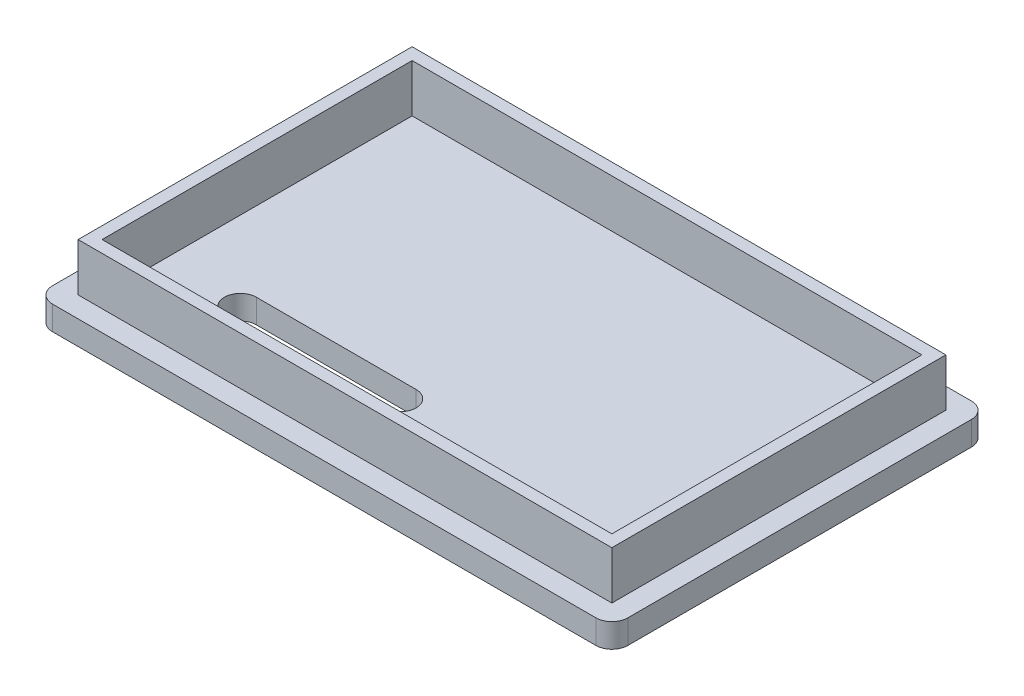
from build123d import *

# Parameters (mm, degrees)
SKETCH2_W           = 72
SKETCH2_H           = 47
BOSS_EXTRUDE1_DEPTH = 3
FILLET1_R           = 2
SKETCH3_W           = 66.8
SKETCH3_H           = 41.8
SKETCH3_W_2         = 63.8
SKETCH3_H_2         = 38.8
BOSS_EXTRUDE2_DEPTH = 6
CUT_EXTRUDE1_DEPTH  = 6


with BuildPart() as part:
    # Sketch2 → Boss-Extrude1 (new body)
    with BuildSketch(Plane(origin=(0, 0, 0), x_dir=(1, 0, 0), z_dir=(0, 1, 0))):
        with Locations((36, 23.5)):
            Rectangle(SKETCH2_W, SKETCH2_H)
    extrude(amount=BOSS_EXTRUDE1_DEPTH)

    # Fillet1
    fillet1_edges = [part.edges().sort_by_distance(p)[0] for p in [
        (0, 1.5, 0),
        (72, 1.5, 0),
        (72, 1.5, -47),
        (0, 1.5, -47),
    ]]
    fillet(fillet1_edges, radius=FILLET1_R)

    # Sketch3 → Boss-Extrude2 (add)
    with BuildSketch(Plane(origin=(0, 3, 0), x_dir=(1, 0, 0), z_dir=(0, 1, 0))):
        with Locations((36, 23.5)):
            Rectangle(SKETCH3_W, SKETCH3_H)
        with Locations((36, 23.5)):
            Rectangle(SKETCH3_W_2, SKETCH3_H_2, mode=Mode.SUBTRACT)
    extrude(amount=BOSS_EXTRUDE2_DEPTH)

    # Sketch4 → Cut-Extrude1 (cut)
    with BuildSketch(Plane.XZ):
        with BuildLine():
            Line((14, -9.5), (34, -9.5))
            ThreePointArc((34, -9.5), (36, -11.5), (34, -13.5))
            Line((34, -13.5), (14, -13.5))
            ThreePointArc((14, -13.5), (12, -11.5), (14, -9.5))
        make_face()
    extrude(amount=-CUT_EXTRUDE1_DEPTH, mode=Mode.SUBTRACT)


solid = part.part
